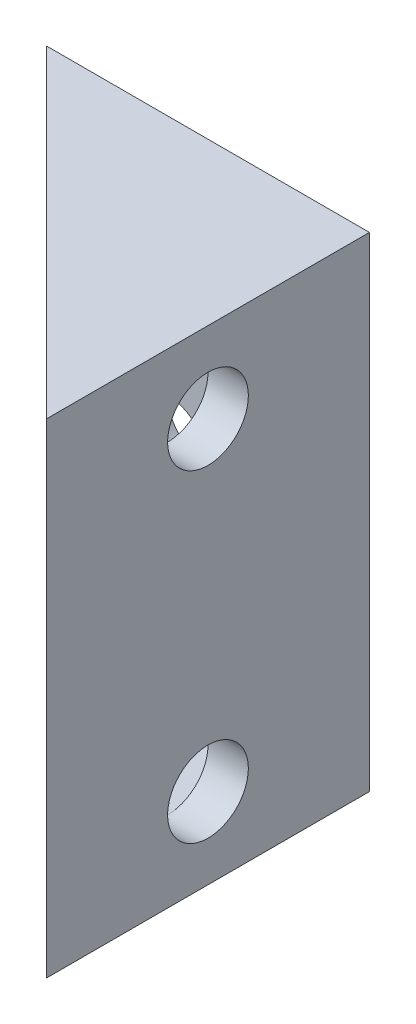
from build123d import *

# Parameters (mm, degrees)
SKETCH1_W           = 25.4
SKETCH1_H           = 25.4
BOSS_EXTRUDE1_DEPTH = 38.1
CUT_EXTRUDE1_DEPTH  = 43.121134838
CUT_EXTRUDE2_START  = -3.175
CUT_EXTRUDE2_DEPTH  = 31.75
SKETCH4_R           = 3.175
CUT_EXTRUDE3_DEPTH  = 48.519048812
SKETCH5_R           = 3.175
CUT_EXTRUDE5_DEPTH  = 48.519048812


with BuildPart() as part:
    # Sketch1 → Boss-Extrude1 (new body)
    with BuildSketch(Plane(origin=(0, 0, 0), x_dir=(1, 0, 0), z_dir=(0, 1, 0))):
        Rectangle(SKETCH1_W, SKETCH1_H)
    extrude(amount=BOSS_EXTRUDE1_DEPTH)

    # Sketch2 → Cut-Extrude1 (cut, through all)
    with BuildSketch(Plane(origin=(0, 38.1, 0), x_dir=(1, 0, 0), z_dir=(0, 1, 0))):
        Polygon((-12.7, 12.7), (12.7, -12.7), (-12.7, -12.7), align=None)
    extrude(amount=-CUT_EXTRUDE1_DEPTH, mode=Mode.SUBTRACT)

    # Sketch3 → Cut-Extrude2 (cut)
    with BuildSketch(Plane(origin=(0, 38.1, 0), x_dir=(1, 0, 0), z_dir=(0, 1, 0)).offset(CUT_EXTRUDE2_START)):
        Polygon((-9.525, 9.525), (9.525, 9.525), (9.525, -9.525), align=None)
    extrude(amount=-CUT_EXTRUDE2_DEPTH, mode=Mode.SUBTRACT)

    # Sketch4 → Cut-Extrude3 (cut, through all)
    with BuildSketch(Plane(origin=(0, 0, -12.7), x_dir=(-1, 0, 0), z_dir=(0, 0, -1))):
        with Locations((0, 19.05)):
            Circle(SKETCH4_R)
    extrude(amount=-CUT_EXTRUDE3_DEPTH, mode=Mode.SUBTRACT)

    # Sketch5 → Cut-Extrude5 (cut, through all)
    with BuildSketch(Plane(origin=(12.7, 0, 0), x_dir=(0, 0, -1), z_dir=(1, 0, 0))):
        with Locations((0, 31.75)):
            Circle(SKETCH5_R)
        with Locations((0, 6.35)):
            Circle(SKETCH5_R)
    extrude(amount=-CUT_EXTRUDE5_DEPTH, mode=Mode.SUBTRACT)


solid = part.part
